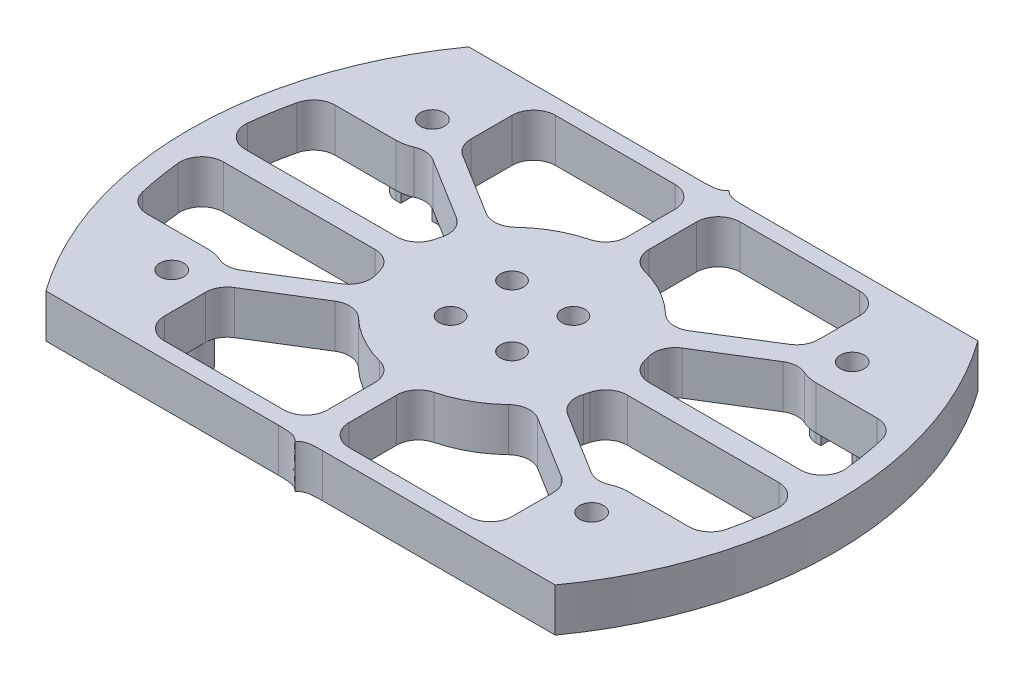
from build123d import *

# Parameters (mm, degrees)
EXTRUDE_1_DEPTH             = 6
CUT_EXTRUDE_1_DEPTH         = 108.640578546
SKETCH_3_R                  = 5
EXTRUDE_2_DEPTH             = 6
EXTRUDE_2_2_DEPTH           = 6
EXTRUDE_2_3_DEPTH           = 6
EXTRUDE_2_4_DEPTH           = 6
SKETCH_3_R_2                = 15
EXTRUDE_2_5_DEPTH           = 6
EXTRUDE_3_DEPTH             = 6
EXTRUDE_4_DEPTH             = 6
FILLET_1_R                  = 3
CUT_EXTRUDE_2_DEPTH         = 108.64057869
M4X0_71_D                   = 3.3
EXTRUDE_5_DEPTH             = 4
M4X0_72_D                   = 3.3
HOLE_WIZARD_M31_D           = 3.2
HOLE_WIZARD_M31_CBORE_D     = 6.5
HOLE_WIZARD_M31_CBORE_DEPTH = 3
SKETCH_15_W                 = 4.3
SKETCH_15_H                 = 40.4
CUT_EXTRUDE_3_DEPTH         = 4


with BuildPart() as part:
    # Эскиз1 → Бобышка-Вытянуть1 (new body)
    with BuildSketch(Plane(origin=(0, 0, 0), x_dir=(1, 0, 0), z_dir=(0, 1, 0))):
        with BuildLine():
            Line((79.165543512, 0), (10, 0))
            ThreePointArc((10, 0), (0, 30), (10, 60))
            Line((10, 60), (79.165543512, 60))
            ThreePointArc((79.165543512, 60), (89.165543512, 30), (79.165543512, 0))
        make_face()
    extrude(amount=EXTRUDE_1_DEPTH)

    # Эскиз2 → Вырез-Вытянуть1 (cut, through all)
    with BuildSketch(Plane(origin=(0, 6, 0), x_dir=(1, 0, 0), z_dir=(0, 1, 0))):
        with BuildLine():
            Line((11.529231877, 3), (77.636311635, 3))
            ThreePointArc((77.636311635, 3), (86.165543512, 30), (77.636311635, 57))
            Line((77.636311635, 57), (11.529231877, 57))
            ThreePointArc((11.529231877, 57), (3, 30), (11.529231877, 3))
        make_face()
    extrude(amount=-CUT_EXTRUDE_1_DEPTH, mode=Mode.SUBTRACT)



with BuildPart() as body_2:
    # Эскиз3 → Бобышка-Вытянуть2 (new, through all)
    with BuildSketch(Plane(origin=(0, 6, 0), x_dir=(1, 0, 0), z_dir=(0, 1, 0))):
        with Locations(Location((15.582771756, 48, 0), (0, 0, 270))):
            Circle(SKETCH_3_R)
    extrude(amount=-EXTRUDE_2_DEPTH)


with BuildPart() as body_3:
    # Эскиз3 → Extrude 2 2 (new, through all)
    with BuildSketch(Plane(origin=(0, 6, 0), x_dir=(1, 0, 0), z_dir=(0, 1, 0))):
        with Locations(Location((73.582771756, 48, 0), (0, 0, 270))):
            Circle(SKETCH_3_R)
    extrude(amount=-EXTRUDE_2_2_DEPTH)


with BuildPart() as body_4:
    # Эскиз3 → Extrude 2 3 (new, through all)
    with BuildSketch(Plane(origin=(0, 6, 0), x_dir=(1, 0, 0), z_dir=(0, 1, 0))):
        with Locations(Location((73.582771756, 12, 0), (0, 0, 90))):
            Circle(SKETCH_3_R)
    extrude(amount=-EXTRUDE_2_3_DEPTH)


with BuildPart() as body_5:
    # Эскиз3 → Extrude 2 4 (new, through all)
    with BuildSketch(Plane(origin=(0, 6, 0), x_dir=(1, 0, 0), z_dir=(0, 1, 0))):
        with Locations(Location((15.582771756, 12, 0), (0, 0, 90))):
            Circle(SKETCH_3_R)
    extrude(amount=-EXTRUDE_2_4_DEPTH)


with BuildPart() as body_6:
    # Эскиз3 → Extrude 2 5 (new, through all)
    with BuildSketch(Plane(origin=(0, 6, 0), x_dir=(1, 0, 0), z_dir=(0, 1, 0))):
        with Locations(Location((44.582771756, 30, 0), (0, 0, 270))):
            Circle(SKETCH_3_R_2)
    extrude(amount=-EXTRUDE_2_5_DEPTH)


with BuildPart() as part_1:
    add(part.part)

    add(body_2.part)  # Бобышка-Вытянуть3 merges body 2

    add(body_3.part)  # Бобышка-Вытянуть3 merges body 3

    add(body_4.part)  # Бобышка-Вытянуть3 merges body 4

    add(body_5.part)  # Бобышка-Вытянуть3 merges body 5

    add(body_6.part)  # Бобышка-Вытянуть3 merges body 6
    # Эскиз4 → Бобышка-Вытянуть3 (add, through all)
    with BuildSketch(Plane(origin=(0, 6, 0), x_dir=(1, 0, 0), z_dir=(0, 1, 0))):
        with BuildLine():
            ThreePointArc((31.111008092, 36.596331085), (31.838169263, 37.910442927), (32.693096677, 39.145251583))
            Line((32.693096677, 39.145251583), (20.426341357, 46.759099713))
            ThreePointArc((20.426341357, 46.759099713), (19.830972587, 45.363185691), (18.844252772, 44.210179215))
            Line((18.844252772, 44.210179215), (31.111008092, 36.596331085))
        make_face()
        with BuildLine():
            ThreePointArc((43.082771756, 44.924811557), (44.582771756, 45), (46.082771756, 44.924811557))
            Line((46.082771756, 44.924811557), (46.082771756, 57))
            Line((46.082771756, 57), (43.082771756, 57))
            Line((43.082771756, 57), (43.082771756, 44.924811557))
        make_face()
        with BuildLine():
            Line((68.739202155, 46.759099713), (56.472446835, 39.145251583))
            ThreePointArc((56.472446835, 39.145251583), (57.327374249, 37.910442927), (58.05453542, 36.596331085))
            Line((58.05453542, 36.596331085), (70.32129074, 44.210179215))
            ThreePointArc((70.32129074, 44.210179215), (69.334570925, 45.363185691), (68.739202155, 46.759099713))
        make_face()
        with BuildLine():
            Line((86.141601244, 31.5), (59.507583313, 31.5))
            ThreePointArc((59.507583313, 31.5), (59.563962853, 30.750941626), (59.582771756, 30))
            ThreePointArc((59.582771756, 30), (59.563962853, 29.249058374), (59.507583313, 28.5))
            Line((59.507583313, 28.5), (86.141601244, 28.5))
            Line((86.141601244, 28.5), (86.672716069, 28.5))
            Line((86.672716069, 28.5), (86.672716069, 31.5))
            Line((86.672716069, 31.5), (86.141601244, 31.5))
        make_face()
        with BuildLine():
            Line((70.32129074, 15.789820785), (58.05453542, 23.403668915))
            ThreePointArc((58.05453542, 23.403668915), (57.327374249, 22.089557073), (56.472446835, 20.854748417))
            Line((56.472446835, 20.854748417), (68.739202155, 13.240900287))
            ThreePointArc((68.739202155, 13.240900287), (69.334570925, 14.636814309), (70.32129074, 15.789820785))
        make_face()
        with BuildLine():
            Line((46.082771756, 3), (46.082771756, 15.075188443))
            ThreePointArc((46.082771756, 15.075188443), (44.582771756, 15), (43.082771756, 15.075188443))
            Line((43.082771756, 15.075188443), (43.082771756, 3))
            Line((43.082771756, 3), (46.082771756, 3))
        make_face()
        with BuildLine():
            ThreePointArc((32.693096677, 20.854748417), (31.838169263, 22.089557073), (31.111008092, 23.403668915))
            Line((31.111008092, 23.403668915), (18.844252772, 15.789820785))
            ThreePointArc((18.844252772, 15.789820785), (19.830972587, 14.636814309), (20.426341357, 13.240900287))
            Line((20.426341357, 13.240900287), (32.693096677, 20.854748417))
        make_face()
        with BuildLine():
            ThreePointArc((29.657960199, 28.5), (29.582771756, 30), (29.657960199, 31.5))
            Line((29.657960199, 31.5), (3.023942268, 31.5))
            Line((3.023942268, 31.5), (2.402125711, 31.5))
            Line((2.402125711, 31.5), (2.402125711, 28.5))
            Line((2.402125711, 28.5), (3.023942268, 28.5))
            Line((3.023942268, 28.5), (29.657960199, 28.5))
        make_face()
    extrude(amount=-EXTRUDE_3_DEPTH)

    # Эскиз5 → Бобышка-Вытянуть4 (add, through all)
    with BuildSketch(Plane.XZ):
        with BuildLine():
            Line((20.582771756, -3), (20.582771756, -12))
            ThreePointArc((20.582771756, -12), (12.04723785, -8.464466094), (15.582771756, -17))
            Line((15.582771756, -17), (4.833640837, -17))
            ThreePointArc((4.833640837, -17), (7.599619516, -9.721742312), (11.529231877, -3))
            Line((11.529231877, -3), (20.582771756, -3))
        make_face()
        with BuildLine():
            Line((84.331902675, -17), (73.582771756, -17))
            ThreePointArc((73.582771756, -17), (77.118305662, -8.464466094), (68.582771756, -12))
            Line((68.582771756, -12), (68.582771756, -3))
            Line((68.582771756, -3), (77.636311635, -3))
            ThreePointArc((77.636311635, -3), (81.565923996, -9.721742312), (84.331902675, -17))
        make_face()
        with BuildLine():
            Line((77.636311635, -57), (68.582771756, -57))
            Line((68.582771756, -57), (68.582771756, -48))
            ThreePointArc((68.582771756, -48), (77.118305662, -51.535533906), (73.582771756, -43))
            Line((73.582771756, -43), (84.331902675, -43))
            ThreePointArc((84.331902675, -43), (81.565923996, -50.278257688), (77.636311635, -57))
        make_face()
        with BuildLine():
            Line((11.529231877, -57), (20.582771756, -57))
            Line((20.582771756, -57), (20.582771756, -48))
            ThreePointArc((20.582771756, -48), (12.04723785, -51.535533906), (15.582771756, -43))
            Line((15.582771756, -43), (4.833640837, -43))
            ThreePointArc((4.833640837, -43), (7.599619516, -50.278257688), (11.529231877, -57))
        make_face()
    extrude(amount=-EXTRUDE_4_DEPTH)

    # Скругление1
    fillet_1_edges = [part_1.edges().sort_by_distance(p)[0] for p in [
        (70.32129074, 3, -44.210179215),
        (58.05453542, 3, -36.596331085),
        (59.507583313, 3, -31.5),
        (59.507583313, 3, -28.5),
        (58.05453542, 3, -23.403668915),
        (70.32129074, 3, -15.789820785),
        (84.331902675, 3, -17),
        (86.141601244, 3, -28.5),
        (86.141601244, 3, -31.5),
        (84.331902675, 3, -43),
        (56.472446835, 3, -39.145251583),
        (46.082771756, 3, -44.924811557),
        (46.082771756, 3, -57),
        (68.582771756, 3, -57),
        (68.739202155, 3, -46.759099713),
        (43.082771756, 3, -44.924811557),
        (43.082771756, 3, -57),
        (20.582771756, 3, -57),
        (32.693096677, 3, -39.145251583),
        (20.426341357, 3, -46.759099713),
        (31.111008092, 3, -36.596331085),
        (18.844252772, 3, -44.210179215),
        (4.833640837, 3, -43),
        (3.023942268, 3, -31.5),
        (29.657960199, 3, -31.5),
        (29.657960199, 3, -28.5),
        (3.023942268, 3, -28.5),
        (4.833640837, 3, -17),
        (18.844252772, 3, -15.789820785),
        (31.111008092, 3, -23.403668915),
        (43.082771756, 3, -3),
        (20.582771756, 3, -3),
        (20.426341357, 3, -13.240900287),
        (32.693096677, 3, -20.854748417),
        (43.082771756, 3, -15.075188443),
        (56.472446835, 3, -20.854748417),
        (46.082771756, 3, -15.075188443),
        (46.082771756, 3, -3),
        (68.582771756, 3, -3),
        (68.739202155, 3, -13.240900287),
    ]]
    fillet(fillet_1_edges, radius=FILLET_1_R)

    # Эскиз8 → Вырез-Вытянуть2 (cut, through all)
    with BuildSketch(Plane.XZ):
        with BuildLine():
            ThreePointArc((10, 0), (9.704173203, -0.398541543), (9.412317139, -0.8))
            Line((9.412317139, -0.8), (41.52777131, -0.8))
            add(Edge.make_bspline(
                [(44.582771756, 0), (43.959141321, -0.703584088), (43.274165183, -0.8), (41.52777131, -0.8)],
                knots=[0, 0, 0, 0, 1, 1, 1, 1], degree=3))
            Line((44.582771756, 0), (10, 0))
        make_face()
        with BuildLine():
            Line((79.165543512, 0), (44.582771756, 0))
            add(Edge.make_bspline(
                [(44.582771756, 0), (45.206402191, -0.703584088), (45.891378329, -0.8), (47.637772202, -0.8)],
                knots=[0, 0, 0, 0, 1, 1, 1, 1], degree=3))
            Line((47.637772202, -0.8), (79.753226373, -0.8))
            ThreePointArc((79.753226373, -0.8), (79.461370308, -0.398541543), (79.165543512, 0))
        make_face()
        with BuildLine():
            Line((10, -60), (44.582771756, -60))
            add(Edge.make_bspline(
                [(44.582771756, -60), (43.959141321, -59.296415912), (43.274165183, -59.2), (41.52777131, -59.2)],
                knots=[0, 0, 0, 0, 1, 1, 1, 1], degree=3))
            Line((41.52777131, -59.2), (9.412317139, -59.2))
            ThreePointArc((9.412317139, -59.2), (9.704173203, -59.601458457), (10, -60))
        make_face()
        with BuildLine():
            Line((44.582771756, -60), (79.165543512, -60))
            ThreePointArc((79.165543512, -60), (79.461370308, -59.601458457), (79.753226373, -59.2))
            Line((79.753226373, -59.2), (47.637772202, -59.2))
            add(Edge.make_bspline(
                [(44.582771756, -60), (45.206402191, -59.296415912), (45.891378329, -59.2), (47.637772202, -59.2)],
                knots=[0, 0, 0, 0, 1, 1, 1, 1], degree=3))
        make_face()
    extrude(amount=-CUT_EXTRUDE_2_DEPTH, mode=Mode.SUBTRACT)

    # Отверстие обработанное метчиком M4x0.71 (through all)
    with Locations(Plane(origin=(0, 0, 0), x_dir=(-1, 0, 0), z_dir=(0, -1, 0))):
        with Locations((-15.582771756, 12), (-73.582771756, 12), (-73.582771756, 48), (-15.582771756, 48)):
            Hole(M4X0_71_D / 2)

    # Эскиз9 → Бобышка-Вытянуть5 (add)
    with BuildSketch(Plane(origin=(0, 0, 0), x_dir=(1, 0, 0), z_dir=(0, 1, 0))):
        with BuildLine():
            Line((12.782771348, 50.2), (18.382772164, 50.2))
            ThreePointArc((18.382772164, 50.2), (20.582771756, 48), (18.382772164, 45.8))
            Line((18.382772164, 45.8), (12.782771348, 45.8))
            ThreePointArc((12.782771348, 45.8), (10.582771756, 48), (12.782771348, 50.2))
        make_face()
        with BuildLine():
            Line((12.782771348, 14.2), (18.382772164, 14.2))
            ThreePointArc((18.382772164, 14.2), (20.582771756, 12), (18.382772164, 9.8))
            Line((18.382772164, 9.8), (12.782771348, 9.8))
            ThreePointArc((12.782771348, 9.8), (10.582771756, 12), (12.782771348, 14.2))
        make_face()
        with BuildLine():
            Line((76.382772164, 45.8), (70.782771348, 45.8))
            ThreePointArc((70.782771348, 45.8), (68.582771756, 48), (70.782771348, 50.2))
            Line((70.782771348, 50.2), (76.382772164, 50.2))
            ThreePointArc((76.382772164, 50.2), (78.582771756, 48), (76.382772164, 45.8))
        make_face()
        with BuildLine():
            Line((76.382772164, 9.8), (70.782771348, 9.8))
            ThreePointArc((70.782771348, 9.8), (68.582771756, 12), (70.782771348, 14.2))
            Line((70.782771348, 14.2), (76.382772164, 14.2))
            ThreePointArc((76.382772164, 14.2), (78.582771756, 12), (76.382772164, 9.8))
        make_face()
    extrude(amount=-EXTRUDE_5_DEPTH)

    # Отверстие обработанное метчиком M4x0.72 (through all)
    with Locations(Plane(origin=(0, -4, 0), x_dir=(-1, 0, 0), z_dir=(0, -1, 0))):
        with Locations((-73.582771756, 48), (-15.582771756, 48), (-15.582771756, 12), (-73.582771756, 12)):
            Hole(M4X0_72_D / 2)

    # Цековка для винта с внутренним шестигранником M31 (through all)
    with Locations(Plane(origin=(0, 0, 0), x_dir=(-1, 0, 0), z_dir=(0, -1, 0))):
        with Locations((-40.340131069, 25.757359313), (-48.825412443, 25.757359313), (-48.825412443, 34.242640687), (-40.340131069, 34.242640687)):
            CounterBoreHole(HOLE_WIZARD_M31_D / 2, HOLE_WIZARD_M31_CBORE_D / 2, HOLE_WIZARD_M31_CBORE_DEPTH)

    # Эскиз15 → Вырез-Вытянуть3 (cut)
    with BuildSketch(Plane.XZ.offset(4)):
        with Locations((15.582771756, -30)):
            Rectangle(SKETCH_15_W, SKETCH_15_H)
        with Locations((73.582771756, -30)):
            Rectangle(SKETCH_15_W, SKETCH_15_H)
    extrude(amount=-CUT_EXTRUDE_3_DEPTH, mode=Mode.SUBTRACT)


solid = part_1.part
